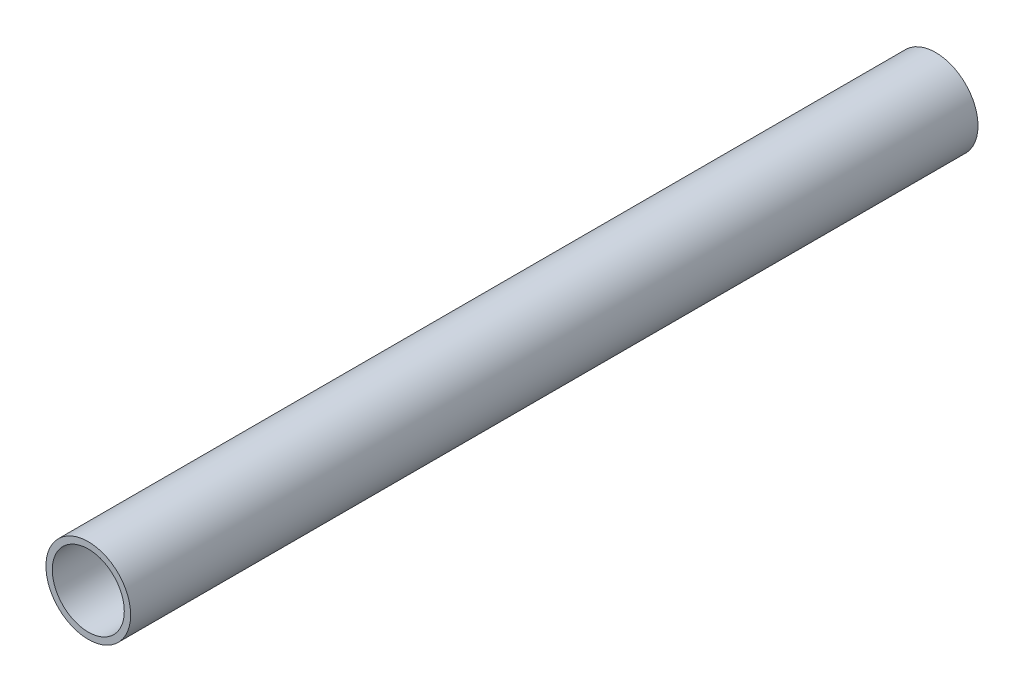
from build123d import *

# Parameters (mm, degrees)
SKETCH_1_R      = 10
SKETCH_1_R_2    = 8.5
EXTRUDE_1_DEPTH = 200


with BuildPart() as part:
    # Эскиз1 → Бобышка-Вытянуть1 (new body)
    with BuildSketch(Plane.XY):
        Circle(SKETCH_1_R)
        Circle(SKETCH_1_R_2, mode=Mode.SUBTRACT)
    extrude(amount=EXTRUDE_1_DEPTH)


solid = part.part
